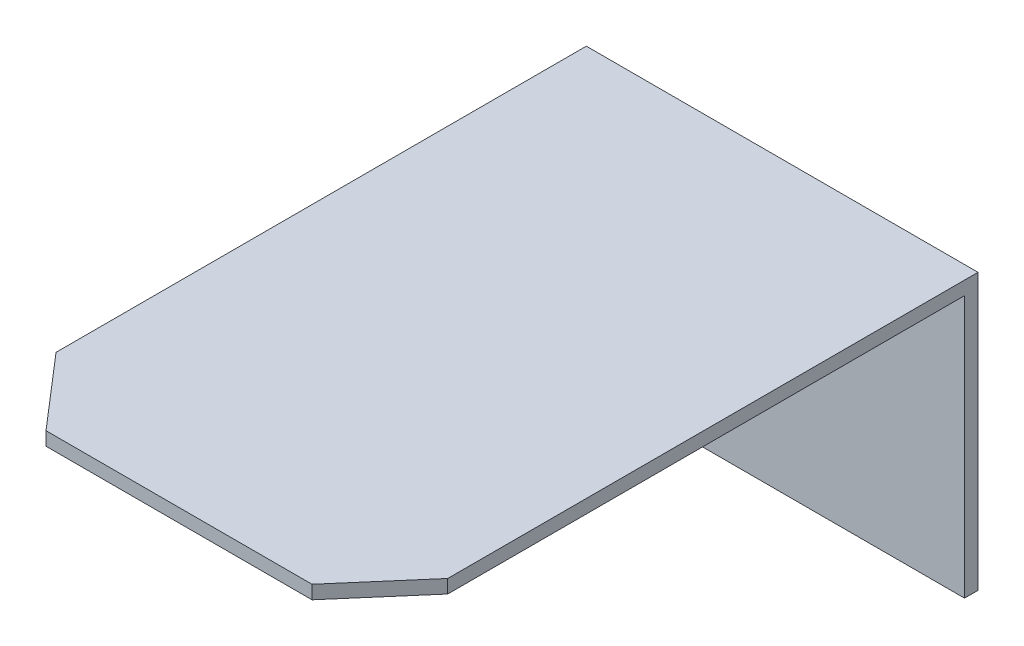
from build123d import *

# Parameters (mm, degrees)
SKETCH1_W               = 34.671
SKETCH1_H               = 52.197
BOSS_EXTRUDE1_DEPTH     = 1.1938
SKETCH3_W               = 34.671
SKETCH3_H               = 24.384
BOSS_EXTRUDE2_DEPTH     = 1.1938
CUT_EXTRUDE1_DEPTH      = 68.752794346
CUT_EXTRUDE1_DEPTH_BACK = 68.752794346


with BuildPart() as part:
    # Sketch1 → Boss-Extrude1 (new body)
    with BuildSketch(Plane(origin=(0, 0, 0), x_dir=(1, 0, 0), z_dir=(0, 1, 0))):
        with Locations((17.3355, 26.0985)):
            Rectangle(SKETCH1_W, SKETCH1_H)
    extrude(amount=BOSS_EXTRUDE1_DEPTH)

    # Sketch3 → Boss-Extrude2 (add)
    with BuildSketch(Plane(origin=(0, 0, -52.197), x_dir=(-1, 0, 0), z_dir=(0, 0, -1))):
        with Locations((-17.3355, -10.9982)):
            Rectangle(SKETCH3_W, SKETCH3_H)
    extrude(amount=BOSS_EXTRUDE2_DEPTH)

    # Sketch4 → Cut-Extrude1 (cut, two sides: drawn at the far end of the back side and taken through both)
    with BuildSketch(Plane(origin=(0, 0, 0), x_dir=(-1, 0, 0), z_dir=(0, -1, 0)).offset(-CUT_EXTRUDE1_DEPTH_BACK)):
        Polygon((0, 6.4516), (-5.5626, 0), (0, 0), align=None)
        Polygon((-29.1084, 0), (-34.671, 6.4516), (-34.671, 0), align=None)
    extrude(amount=CUT_EXTRUDE1_DEPTH + CUT_EXTRUDE1_DEPTH_BACK, mode=Mode.SUBTRACT)


solid = part.part
